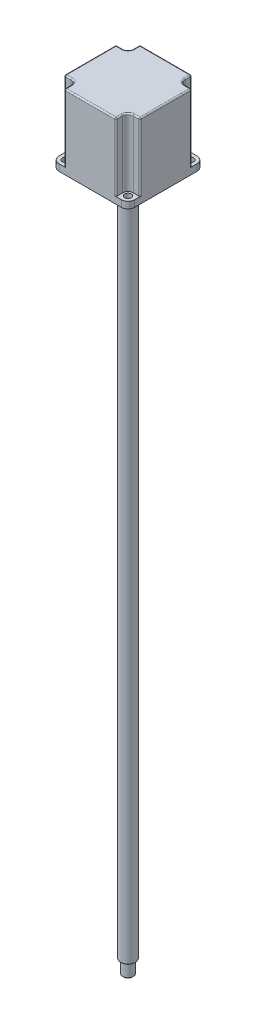
from build123d import *

# Parameters (mm, degrees)
SKETCH1_W                = 57
SKETCH1_H                = 57
EXTRUDE1_DEPTH           = 76
F_5_0_5_DIAMETER_HOLE1_D = 5
SKETCH6_R                = 4
SKETCH6_R_2              = 2.5
EXTRUDE4_DEPTH           = 71
FILLET1_R                = 5
SKETCH7_R                = 3
EXTRUDE5_DEPTH           = 101
SKETCH8_R                = 19.05
EXTRUDE6_DEPTH           = 3
FILLET2_R                = 1
SKETCH9_R                = 5.5
BOSS_EXTRUDE1_DEPTH      = 516
CHAMFER1_SIZE            = 0.5
SKETCH10_R               = 4
BOSS_EXTRUDE2_DEPTH      = 10
CHAMFER2_SIZE            = 0.5
CUT_EXTRUDE1_REACH       = 531.846
SKETCH11_W               = 149.278962391
SKETCH11_H               = 91.97748865
FILLET3_R                = 1


with BuildPart() as part:
    # Sketch1 → Extrude1 (new body)
    with BuildSketch(Plane(origin=(0, 0, 0), x_dir=(1, 0, 0), z_dir=(0, 1, 0))):
        Rectangle(SKETCH1_W, SKETCH1_H)
    extrude(amount=EXTRUDE1_DEPTH)

    # Ø5.0 (5) Diameter Hole1 (through all)
    with Locations(Plane.XZ):
        with Locations((-23.5, 23.5), (23.5, 23.5), (23.5, -23.5), (-23.5, -23.5)):
            Hole(F_5_0_5_DIAMETER_HOLE1_D / 2)

    # Sketch6 → Extrude4 (cut)
    # profile 1 of 12: a face of its own
    with BuildSketch(Plane(origin=(0, 76, 0), x_dir=(1, 0, 0), z_dir=(0, 1, 0))):
        Polygon((-28.5, 28.5), (-19.5, 28.5), (-19.5, 32.511741208), (-33.908905561, 32.511741208), (-33.908905561, 19.5), (-28.5, 19.5), align=None)
    # profile 2 of 12: a face of its own
    with BuildSketch(Plane(origin=(0, 76, 0), x_dir=(1, 0, 0), z_dir=(0, 1, 0))):
        with BuildLine():
            ThreePointArc((-23.5, 19.5), (-26.328427125, 26.328427125), (-19.5, 23.5))
            Line((-19.5, 23.5), (-19.5, 28.5))
            Line((-19.5, 28.5), (-28.5, 28.5))
            Line((-28.5, 28.5), (-28.5, 19.5))
            Line((-28.5, 19.5), (-23.5, 19.5))
        make_face()
    # profile 3 of 12: a face of its own
    with BuildSketch(Plane(origin=(0, 76, 0), x_dir=(1, 0, 0), z_dir=(0, 1, 0))):
        with Locations((-23.5, 23.5)):
            Circle(SKETCH6_R)
        with Locations(Location((-23.5, 23.5, 0), (0, 0, 90))):
            Circle(SKETCH6_R_2, mode=Mode.SUBTRACT)
    # profile 4 of 12: a face of its own
    with BuildSketch(Plane(origin=(0, 76, 0), x_dir=(1, 0, 0), z_dir=(0, 1, 0))):
        Polygon((19.5, 36.471560472), (19.5, 28.5), (28.5, 28.5), (28.5, 19.5), (41.168352552, 19.5), (41.168352552, 36.471560472), align=None)
    # profile 5 of 12: a face of its own
    with BuildSketch(Plane(origin=(0, 76, 0), x_dir=(1, 0, 0), z_dir=(0, 1, 0))):
        with BuildLine():
            Line((28.5, 28.5), (19.5, 28.5))
            Line((19.5, 28.5), (19.5, 23.5))
            ThreePointArc((19.5, 23.5), (23.5, 27.5), (27.5, 23.5))
            ThreePointArc((27.5, 23.5), (26.328427125, 20.671572875), (23.5, 19.5))
            Line((23.5, 19.5), (28.5, 19.5))
            Line((28.5, 19.5), (28.5, 28.5))
        make_face()
    # profile 6 of 12: a face of its own
    with BuildSketch(Plane(origin=(0, 76, 0), x_dir=(1, 0, 0), z_dir=(0, 1, 0))):
        with Locations((23.5, 23.5)):
            Circle(SKETCH6_R)
        with Locations(Location((23.5, 23.5, 0), (0, 0, 90))):
            Circle(SKETCH6_R_2, mode=Mode.SUBTRACT)
    # profile 7 of 12: a face of its own
    with BuildSketch(Plane(origin=(0, 76, 0), x_dir=(1, 0, 0), z_dir=(0, 1, 0))):
        with Locations((23.5, -23.5)):
            Circle(SKETCH6_R)
        with Locations(Location((23.5, -23.5, 0), (0, 0, 90))):
            Circle(SKETCH6_R_2, mode=Mode.SUBTRACT)
    # profile 8 of 12: a face of its own
    with BuildSketch(Plane(origin=(0, 76, 0), x_dir=(1, 0, 0), z_dir=(0, 1, 0))):
        with BuildLine():
            Line((28.5, -28.5), (28.5, -19.5))
            Line((28.5, -19.5), (23.5, -19.5))
            ThreePointArc((23.5, -19.5), (26.328427125, -20.671572875), (27.5, -23.5))
            ThreePointArc((27.5, -23.5), (23.5, -27.5), (19.5, -23.5))
            Line((19.5, -23.5), (19.5, -28.5))
            Line((19.5, -28.5), (28.5, -28.5))
        make_face()
    # profile 9 of 12: a face of its own
    with BuildSketch(Plane(origin=(0, 76, 0), x_dir=(1, 0, 0), z_dir=(0, 1, 0))):
        Polygon((44.252209519, -19.5), (28.5, -19.5), (28.5, -28.5), (19.5, -28.5), (19.5, -40.050429997), (44.252209519, -40.050429997), align=None)
    # profile 10 of 12: a face of its own
    with BuildSketch(Plane(origin=(0, 76, 0), x_dir=(1, 0, 0), z_dir=(0, 1, 0))):
        Polygon((-28.5, -28.5), (-28.5, -19.5), (-37.670786859, -19.5), (-37.670786859, -37.828231874), (-19.5, -37.828231874), (-19.5, -28.5), align=None)
    # profile 11 of 12: a face of its own
    with BuildSketch(Plane(origin=(0, 76, 0), x_dir=(1, 0, 0), z_dir=(0, 1, 0))):
        with BuildLine():
            Line((-23.5, -19.5), (-28.5, -19.5))
            Line((-28.5, -19.5), (-28.5, -28.5))
            Line((-28.5, -28.5), (-19.5, -28.5))
            Line((-19.5, -28.5), (-19.5, -23.5))
            ThreePointArc((-19.5, -23.5), (-26.328427125, -26.328427125), (-23.5, -19.5))
        make_face()
    # profile 12 of 12: a face of its own
    with BuildSketch(Plane(origin=(0, 76, 0), x_dir=(1, 0, 0), z_dir=(0, 1, 0))):
        with Locations((-23.5, -23.5)):
            Circle(SKETCH6_R)
        with Locations(Location((-23.5, -23.5, 0), (0, 0, 90))):
            Circle(SKETCH6_R_2, mode=Mode.SUBTRACT)
    extrude(amount=-EXTRUDE4_DEPTH, mode=Mode.SUBTRACT)

    # Fillet1
    fillet1_edges = [part.edges().sort_by_distance(p)[0] for p in [
        (-28.5, 2.5, 28.5),
        (-28.5, 2.5, -28.5),
        (28.5, 2.5, -28.5),
        (28.5, 2.5, 28.5),
    ]]
    fillet(fillet1_edges, radius=FILLET1_R)



with BuildPart() as body_2:
    # Sketch7 → Extrude5 (new body)
    with BuildSketch(Plane(origin=(0, 76, 0), x_dir=(1, 0, 0), z_dir=(0, 1, 0))):
        with Locations(Location((0, 0, 0), (0, 0, 270))):
            Circle(SKETCH7_R)
    extrude(amount=-EXTRUDE5_DEPTH)


with BuildPart() as part_1:
    add(part.part)

    add(body_2.part)  # Extrude6 merges body 2
    # Sketch8 → Extrude6 (add)
    with BuildSketch(Plane.XZ):
        with Locations(Location((0, 0, 0), (0, 0, 270))):
            Circle(SKETCH8_R)
    extrude(amount=EXTRUDE6_DEPTH)

    # Fillet2
    fillet2_edges = [part_1.edges().sort_by_distance(p)[0] for p in [
        (-28.5, 40.5, 19.5),
        (0, 76, 28.5),
        (-19.5, 40.5, 28.5),
        (-19.5, 76, 26),
        (-20.671572875, 76, 20.671572875),
        (-26, 76, 19.5),
        (-28.5, 76, 0),
        (-28.5, 40.5, -19.5),
        (-19.5, 40.5, -28.5),
        (-19.5, 76, -26),
        (-26, 76, -19.5),
        (-20.671572875, 76, -20.671572875),
        (0, 76, -28.5),
        (19.5, 76, -26),
        (26, 76, -19.5),
        (20.671572875, 76, -20.671572875),
        (19.5, 40.5, -28.5),
        (28.5, 40.5, -19.5),
        (19.5, 40.5, 28.5),
        (28.5, 76, 0),
        (26, 76, 19.5),
        (19.5, 76, 26),
        (20.671572875, 76, 20.671572875),
        (28.5, 40.5, 19.5),
    ]]
    fillet(fillet2_edges, radius=FILLET2_R)

    # Sketch9 → Boss-Extrude1 (add)
    with BuildSketch(Plane.XZ):
        with Locations(Location((0, 0, 0), (0, 0, 270))):
            Circle(SKETCH9_R)
    extrude(amount=BOSS_EXTRUDE1_DEPTH)

    # Chamfer1
    chamfer1_edges = [part_1.edges().sort_by_distance(p)[0] for p in [
        (0, -516, 5.5),
    ]]
    chamfer(chamfer1_edges, length=CHAMFER1_SIZE)

    # Sketch10 → Boss-Extrude2 (add)
    with BuildSketch(Plane.XZ.offset(516)):
        with Locations(Location((0, 0, 0), (0, 0, 270))):
            Circle(SKETCH10_R)
    extrude(amount=BOSS_EXTRUDE2_DEPTH)

    # Chamfer2
    chamfer2_edges = [part_1.edges().sort_by_distance(p)[0] for p in [
        (0, -526, 4),
    ]]
    chamfer(chamfer2_edges, length=CHAMFER2_SIZE)

    # Sketch11 → Cut-Extrude1 (cut, up to next)
    with BuildSketch(Plane.XY.offset(28.5), mode=Mode.PRIVATE) as cut_extrude1_sk1:
        with Locations((-31.906305919, 101.988744325)):
            Rectangle(SKETCH11_W, SKETCH11_H)
    cut_extrude1_tool1 = extrude(cut_extrude1_sk1.sketch, amount=-CUT_EXTRUDE1_REACH, mode=Mode.PRIVATE) & part_1.part
    add(cut_extrude1_tool1.solids().sort_by_distance((-31.906306, 101.988744, 28.5))[0], mode=Mode.SUBTRACT)

    # Fillet3
    fillet3_edges = [part_1.edges().sort_by_distance(p)[0] for p in [
        (19.5, 56, 25.5),
        (19.207106781, 56, 28.207106781),
        (-19.207106781, 56, 28.207106781),
        (-28.207106781, 56, 19.207106781),
        (-28.207106781, 56, -19.207106781),
        (-19.207106781, 56, -28.207106781),
        (19.207106781, 56, -28.207106781),
        (19.5, 56, -25.5),
        (25.5, 56, -19.5),
        (28.207106781, 56, -19.207106781),
        (28.207106781, 56, 19.207106781),
        (25.5, 56, 19.5),
        (0, 56, 28.5),
        (28.5, 56, 0),
        (0, 56, -28.5),
        (-28.5, 56, 0),
        (-25.5, 56, -19.5),
        (-19.5, 56, -25.5),
        (-20.671572875, 56, -20.671572875),
        (20.671572875, 56, -20.671572875),
        (20.671572875, 56, 20.671572875),
        (-19.5, 56, 25.5),
        (-25.5, 56, 19.5),
        (-20.671572875, 56, 20.671572875),
    ]]
    fillet(fillet3_edges, radius=FILLET3_R)


solid = part_1.part
